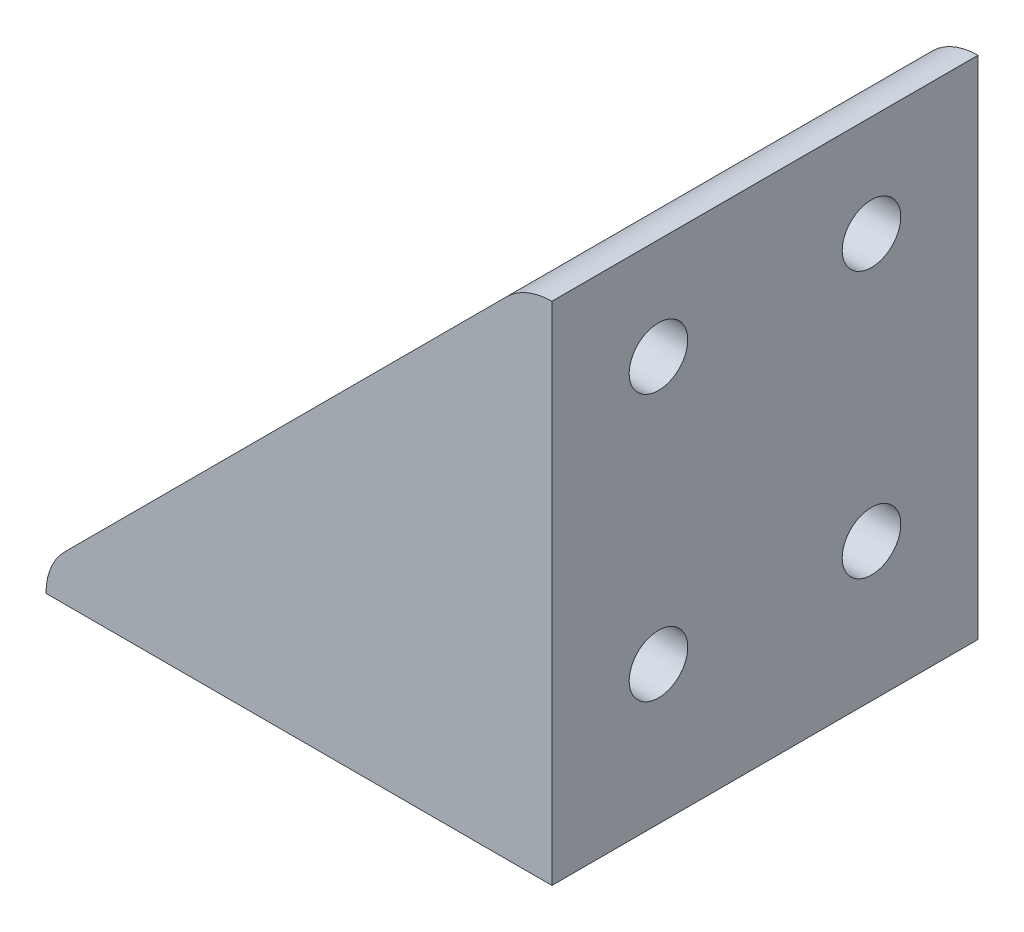
from build123d import *

# Parameters (mm, degrees)
SKETCH1_W                = 50
SKETCH1_H                = 40
BOSS_EXTRUDE1_DEPTH      = 50
CUT_EXTRUDE1_DEPTH       = 69.738635424
SHELL1_T                 = -5
M5_CLEARANCE_HOLE1_D     = 5.5
M5_CLEARANCE_HOLE1_DEPTH = 12
M5_CLEARANCE_HOLE1_TIP   = 1.652366702
CUT_EXTRUDE2_DEPTH       = 1
CUT_EXTRUDE3_DEPTH       = 1
CUT_EXTRUDE4_DEPTH       = 69.738635424
FILLET2_R                = 6
M5_CLEARANCE_HOLE2_D     = 5.5
M5_CLEARANCE_HOLE2_DEPTH = 12
M5_CLEARANCE_HOLE2_TIP   = 1.652366702
BOSS_EXTRUDE2_DEPTH      = 2
BOSS_EXTRUDE2_DEPTH_BACK = 2


with BuildPart() as part:
    # Sketch1 → Boss-Extrude1 (new body)
    with BuildSketch(Plane(origin=(0, 0, 0), x_dir=(1, 0, 0), z_dir=(0, 1, 0))):
        Rectangle(SKETCH1_W, SKETCH1_H)
    extrude(amount=BOSS_EXTRUDE1_DEPTH)

    # Sketch2 → Cut-Extrude1 (cut, through all)
    with BuildSketch(Plane.XY.offset(20)):
        Polygon((-25, 0), (25, 50), (-25, 50), align=None)
    extrude(amount=-CUT_EXTRUDE1_DEPTH, mode=Mode.SUBTRACT)

    # Shell1
    shell1_openings = [part.faces().sort_by_distance(p)[0] for p in [
        (0, 25, 0),
    ]]
    offset(amount=SHELL1_T, openings=shell1_openings, kind=Kind.INTERSECTION)

    # M5 Clearance Hole1
    with Locations(Plane.ZY.offset(-20)):
        with Locations((-10, 38), (-10, 13), (10, 13), (10, 38)):
            Hole(M5_CLEARANCE_HOLE1_D / 2, depth=M5_CLEARANCE_HOLE1_DEPTH)
            with Locations((0, 0, -(M5_CLEARANCE_HOLE1_DEPTH + M5_CLEARANCE_HOLE1_TIP / 2))):  # 118° drill point
                Cone(0, M5_CLEARANCE_HOLE1_D / 2, M5_CLEARANCE_HOLE1_TIP, mode=Mode.SUBTRACT)

    # Sketch5 → Cut-Extrude2 (cut)
    with BuildSketch(Plane.XY.offset(-15)):
        Polygon((-20, 5), (20, 5), (20, 45), align=None)
    extrude(amount=-CUT_EXTRUDE2_DEPTH, mode=Mode.SUBTRACT)

    # Sketch6 → Cut-Extrude3 (cut)
    with BuildSketch(Plane(origin=(0, 0, 15), x_dir=(-1, 0, 0), z_dir=(0, 0, -1))):
        Polygon((-20, 45), (-20, 5), (20, 5), align=None)
    extrude(amount=-CUT_EXTRUDE3_DEPTH, mode=Mode.SUBTRACT)

    # Sketch7 → Cut-Extrude4 (cut, through all)
    with BuildSketch(Plane.XY.offset(20)):
        Polygon((-22.5, 2.5), (-22.5, 0), (-25, 0), align=None)
        Polygon((22.5, 47.5), (25, 47.5), (25, 50), align=None)
    extrude(amount=-CUT_EXTRUDE4_DEPTH, mode=Mode.SUBTRACT)

    # Fillet2
    fillet2_edges = [part.edges().sort_by_distance(p)[0] for p in [
        (-22.5, 2.5, 0),
        (22.5, 47.5, 0),
    ]]
    fillet(fillet2_edges, radius=FILLET2_R)

    # M5 Clearance Hole2
    with Locations(Plane(origin=(0, 5, 0), x_dir=(1, 0, 0), z_dir=(0, 1, 0))):
        with Locations((12, 10), (12, -10), (-13, 10), (-13, -10)):
            Hole(M5_CLEARANCE_HOLE2_D / 2, depth=M5_CLEARANCE_HOLE2_DEPTH)
            with Locations((0, 0, -(M5_CLEARANCE_HOLE2_DEPTH + M5_CLEARANCE_HOLE2_TIP / 2))):  # 118° drill point
                Cone(0, M5_CLEARANCE_HOLE2_D / 2, M5_CLEARANCE_HOLE2_TIP, mode=Mode.SUBTRACT)

    # Sketch10 → Boss-Extrude2 (add, two sides: drawn at the far end of the back side and taken through both)
    with BuildSketch(Plane.XY.offset(-BOSS_EXTRUDE2_DEPTH_BACK)):
        Polygon((20, 45), (20, 5), (-20, 5), align=None)
    extrude(amount=BOSS_EXTRUDE2_DEPTH + BOSS_EXTRUDE2_DEPTH_BACK)


solid = part.part
